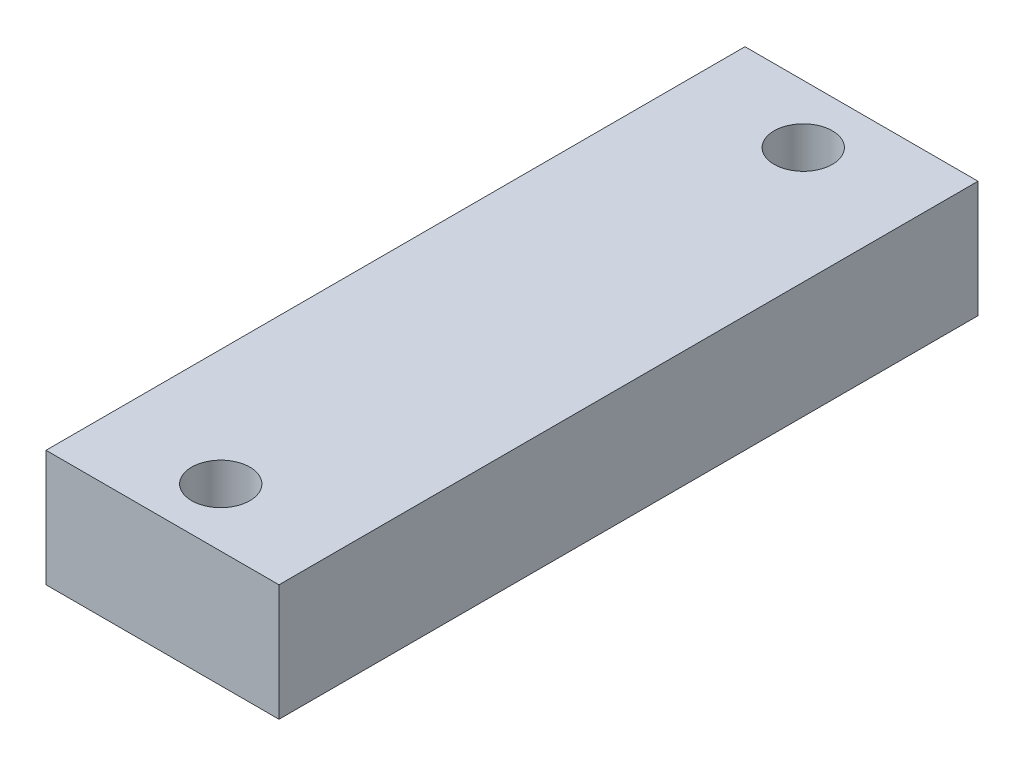
from build123d import *

# Parameters (mm, degrees)
SKETCH1_W           = 12.7
SKETCH1_H           = 38.1
SKETCH1_R           = 1.5875
BOSS_EXTRUDE1_DEPTH = 6.35


with BuildPart() as part:
    # Sketch1 → Boss-Extrude1 (new body)
    with BuildSketch(Plane(origin=(0, 0, 0), x_dir=(1, 0, 0), z_dir=(0, 1, 0))):
        with Locations((6.35, 19.05)):
            Rectangle(SKETCH1_W, SKETCH1_H)
        with Locations(Location((6.35, 34.925, 0), (0, 0, 270))):
            Circle(SKETCH1_R, mode=Mode.SUBTRACT)
        with Locations(Location((6.35, 3.175, 0), (0, 0, 270))):
            Circle(SKETCH1_R, mode=Mode.SUBTRACT)
    extrude(amount=BOSS_EXTRUDE1_DEPTH)


solid = part.part
